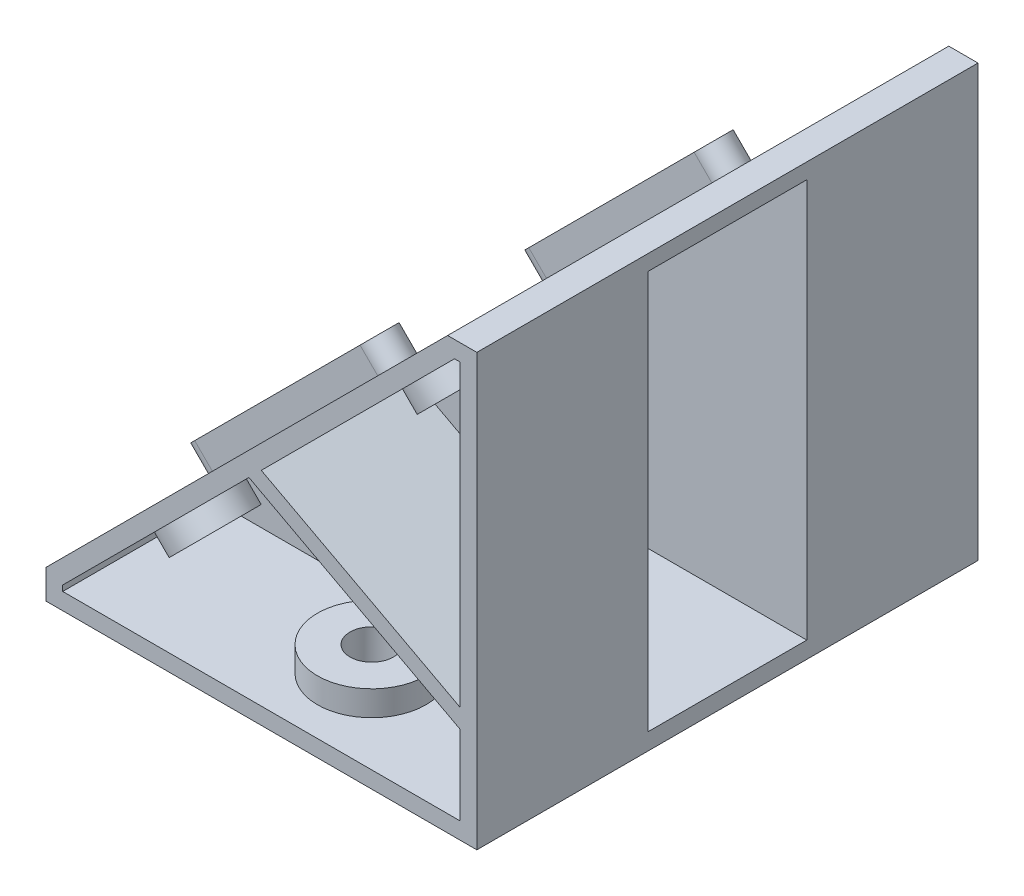
from build123d import *
from build123d.topology import SkipClean

# Parameters (mm, degrees)
EXTRUDE_1_DEPTH     = 60
CUT_EXTRUDE_1_DEPTH = 18.5
CUT_EXTRUDE_2_DEPTH = 18.5
SKETCH_5_R          = 2.1
CUT_EXTRUDE_3_DEPTH = 3
CUT_EXTRUDE_START   = -2
CUT_EXTRUDE_4_DEPTH = 19
SKETCH_9_R          = 4.5
SKETCH_9_R_2        = 2.1
EXTRUDE_2_DEPTH     = 2.5
SKETCH_11_R         = 2.6
CUT_EXTRUDE_5_DEPTH = 3
EXTRUDE_START       = 3
SKETCH_12_R         = 6.5
SKETCH_12_R_2       = 2.6
EXTRUDE_3_DEPTH     = 3
EXTRUDE_4_DEPTH     = 18.5
EXTRUDE_8_DEPTH     = 18.5
EXTRUDE_9_DEPTH     = 3


with BuildPart() as part:
    # 草图1 → 凸台-拉伸1 (new body)
    with BuildSketch(Plane.XY):
        Polygon((0, 0), (0, 51.583261121), (-3.5, 51.583261121), (-51.583261121, 3.5), (-51.583261121, 0), align=None)
    extrude(amount=EXTRUDE_1_DEPTH)

    # 草图3 → 切除-拉伸1 (cut)
    with BuildSketch(Plane.XY.offset(60)):
        Polygon((-49.583261121, 2), (-2, 2), (-2, 49.583261121), (-2.671572875, 49.583261121), (-49.583261121, 2.671572875), align=None)
    extrude(amount=-CUT_EXTRUDE_1_DEPTH, mode=Mode.SUBTRACT)

    # 草图4 → 切除-拉伸2 (cut)
    with BuildSketch(Plane(origin=(0, 0, 0), x_dir=(-1, 0, 0), z_dir=(0, 0, -1))):
        Polygon((2, 2), (49.583261121, 2), (49.583261121, 2.671572875), (2.671572875, 49.583261121), (2, 49.583261121), align=None)
    extrude(amount=-CUT_EXTRUDE_2_DEPTH, mode=Mode.SUBTRACT)

    # 草图5 → 切除-拉伸3 (cut)
    with BuildSketch(Plane(origin=(-27.54163056, 27.54163056, 0), x_dir=(0, 0, 1), z_dir=(-0.7071067811865398, 0.7071067811865552, 0))):
        with Locations(Location((10, 18, 0), (0, 0, 270))):
            Circle(SKETCH_5_R)
        with Locations(Location((10, -24, 0), (0, 0, 270))):
            Circle(SKETCH_5_R)
        with Locations(Location((50, -24, 0), (0, 0, 270))):
            Circle(SKETCH_5_R)
        with Locations(Location((50, 18, 0), (0, 0, 270))):
            Circle(SKETCH_5_R)
    extrude(amount=-CUT_EXTRUDE_3_DEPTH, mode=Mode.SUBTRACT)

    # 草图6 → 切除-拉伸4 (cut)
    with BuildSketch(Plane(origin=(0, 0, 18.5), x_dir=(-1, 0, 0), z_dir=(0, 0, -1)).offset(CUT_EXTRUDE_START)):
        Polygon((49.583261121, 2), (49.583261121, 2.671572875), (2.525126266, 49.72970773), (-2.717199738, 49.72970773), (-2.717199738, 2), align=None)
    extrude(amount=-CUT_EXTRUDE_4_DEPTH, mode=Mode.SUBTRACT)

    # 草图9 → 凸台-拉伸2 (add)
    # profile 1 of 4: a face of its own
    with SkipClean():  # the faces are left unmerged after this step: merging them gives an invalid solid
        with BuildSketch(Plane(origin=(-26.127416998, 26.127416998, 0), x_dir=(0, 0, -1), z_dir=(0.7071067811865432, -0.7071067811865519, 0))):
            with Locations(Location((-10, 18, 0), (0, 0, 270))):
                Circle(SKETCH_9_R)
            with Locations(Location((-10, 18, 0), (0, 0, 270))):
                Circle(SKETCH_9_R_2, mode=Mode.SUBTRACT)
        # profile 2 of 4: a face of its own
        with BuildSketch(Plane(origin=(-26.127416998, 26.127416998, 0), x_dir=(0, 0, -1), z_dir=(0.7071067811865432, -0.7071067811865519, 0))):
            with Locations(Location((-10, -24, 0), (0, 0, 270))):
                Circle(SKETCH_9_R)
            with Locations(Location((-10, -24, 0), (0, 0, 270))):
                Circle(SKETCH_9_R_2, mode=Mode.SUBTRACT)
        # profile 3 of 4: a face of its own
        with BuildSketch(Plane(origin=(-26.127416998, 26.127416998, 0), x_dir=(0, 0, -1), z_dir=(0.7071067811865432, -0.7071067811865519, 0))):
            with Locations(Location((-50, 18, 0), (0, 0, 270))):
                Circle(SKETCH_9_R)
            with Locations(Location((-50, 18, 0), (0, 0, 90))):
                Circle(SKETCH_9_R_2, mode=Mode.SUBTRACT)
        # profile 4 of 4: a face of its own
        with BuildSketch(Plane(origin=(-26.127416998, 26.127416998, 0), x_dir=(0, 0, -1), z_dir=(0.7071067811865432, -0.7071067811865519, 0))):
            with Locations(Location((-50, -24, 0), (0, 0, 270))):
                Circle(SKETCH_9_R)
            with Locations(Location((-50, -24, 0), (0, 0, 90))):
                Circle(SKETCH_9_R_2, mode=Mode.SUBTRACT)
        extrude(amount=EXTRUDE_2_DEPTH)

    # 草图11 → 切除-拉伸5 (cut)
    with SkipClean():  # the faces are left unmerged after this step: merging them gives an invalid solid
        with BuildSketch(Plane(origin=(0, 2, 0), x_dir=(1, 0, 0), z_dir=(0, 1, 0))):
            with Locations(Location((-22.583261121, -10, 0), (0, 0, 180))):
                Circle(SKETCH_11_R)
            with Locations(Location((-22.583261121, -50, 0), (0, 0, 270))):
                Circle(SKETCH_11_R)
        extrude(amount=-CUT_EXTRUDE_5_DEPTH, mode=Mode.SUBTRACT)

    # 草图12 → 凸台-拉伸3 (add)
    # profile 1 of 2: a face of its own
    with SkipClean():  # the faces are left unmerged after this step: merging them gives an invalid solid
        with BuildSketch(Plane(origin=(0, 2, 0), x_dir=(1, 0, 0), z_dir=(0, 1, 0)).offset(EXTRUDE_START)):
            with Locations((-22.583261121, -10)):
                Circle(SKETCH_12_R)
            with Locations(Location((-22.583261121, -10, 0), (0, 0, 180))):
                Circle(SKETCH_12_R_2, mode=Mode.SUBTRACT)
        # profile 2 of 2: a face of its own
        with BuildSketch(Plane(origin=(0, 2, 0), x_dir=(1, 0, 0), z_dir=(0, 1, 0)).offset(EXTRUDE_START)):
            with Locations((-22.583261121, -50)):
                Circle(SKETCH_12_R)
            with Locations(Location((-22.583261121, -50, 0), (0, 0, 270))):
                Circle(SKETCH_12_R_2, mode=Mode.SUBTRACT)
        extrude(amount=-EXTRUDE_3_DEPTH)

    # 草图13 → 凸台-拉伸4 (add)
    with SkipClean():  # the faces are left unmerged after this step: merging them gives an invalid solid
        with BuildSketch(Plane.XY.offset(41.5)):
            Polygon((-2, 11.5), (-27.287858206, 24.966975789), (-25.809321526, 26.44551247), (-2, 13.765927116), align=None)
        extrude(amount=EXTRUDE_4_DEPTH)

    # 草图14 → 凸台-拉伸8 (add)
    with SkipClean():  # the faces are left unmerged after this step: merging them gives an invalid solid
        with BuildSketch(Plane(origin=(0, 0, 18.5), x_dir=(-1, 0, 0), z_dir=(0, 0, -1))):
            Polygon((2, 11.5), (2, 13.765927116), (25.809321526, 26.44551247), (27.287858206, 24.966975789), align=None)
        extrude(amount=EXTRUDE_8_DEPTH)

    # 草图18 → 凸台-拉伸9 (add)
    with SkipClean():  # the faces are left unmerged after this step: merging them gives an invalid solid
        with BuildSketch(Plane(origin=(-27.54163056, 27.54163056, 0), x_dir=(0, 0, 1), z_dir=(-0.70710678118654, 0.7071067811865551, 0))):
            with BuildLine():
                Line((12.1, 11), (12.1, -17))
                ThreePointArc((12.1, -17), (10, -19.1), (7.9, -17))
                Line((7.9, -17), (7.9, 11))
                ThreePointArc((7.9, 11), (10, 13.1), (12.1, 11))
            make_face()
            with BuildLine():
                Line((52.1, 11), (52.1, -17))
                ThreePointArc((52.1, -17), (50, -19.1), (47.9, -17))
                Line((47.9, -17), (47.9, 11))
                ThreePointArc((47.9, 11), (50, 13.1), (52.1, 11))
            make_face()
        extrude(amount=EXTRUDE_9_DEPTH)


solid = part.part
